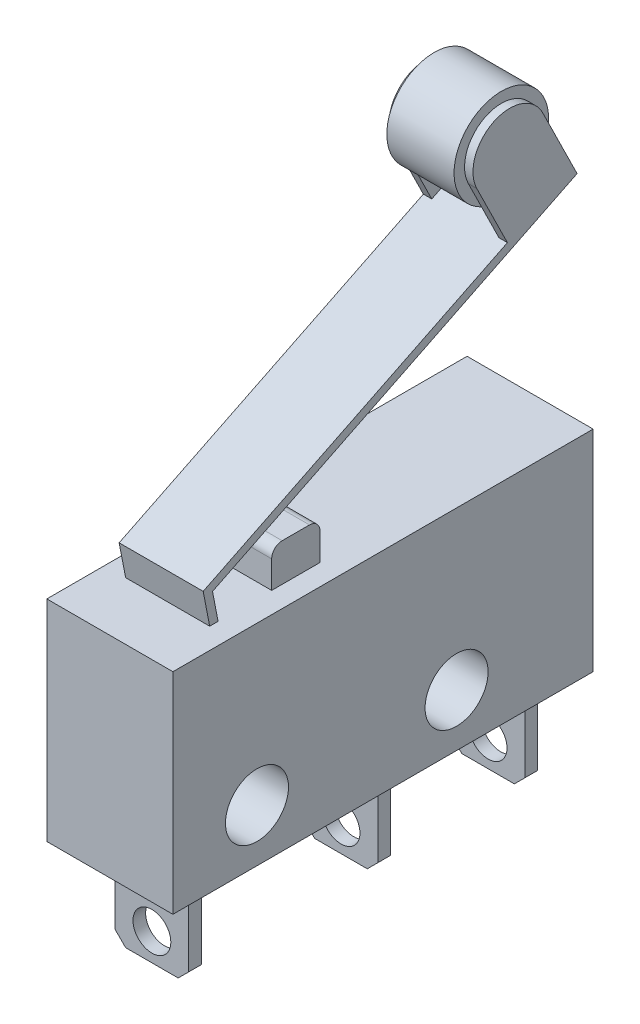
from build123d import *

# Parameters (mm, degrees)
CROQUIS2_W              = 20
CROQUIS2_H              = 10
SALIENTE_EXTRUIR1_DEPTH = 3
SALIENTE_EXTRUIR2_DEPTH = 2
CROQUIS4_W              = 3.2
CROQUIS4_H              = 5.473345926
CORTAR_EXTRUIR1_DEPTH   = 4
CROQUIS5_R              = 2.25
SALIENTE_EXTRUIR3_DEPTH = 3.2
CROQUIS6_R              = 1.5
CORTAR_EXTRUIR2_DEPTH   = 24.003733896
CROQUIS7_W              = 0.6
CROQUIS7_H              = 4.5
SALIENTE_EXTRUIR4_DEPTH = 1.75
CROQUIS8_R              = 0.9
CORTAR_EXTRUIR3_DEPTH   = 28.017462518


with BuildPart() as part:
    # Croquis2 → Saliente-Extruir1 (new, symmetric)
    with BuildSketch(Plane(origin=(0, 0, 0), x_dir=(0, 0, -1), z_dir=(1, 0, 0))):
        Rectangle(CROQUIS2_W, CROQUIS2_H)
    extrude(amount=SALIENTE_EXTRUIR1_DEPTH, both=True)

    # Croquis3 → Saliente-Extruir2 (add, symmetric)
    with BuildSketch(Plane(origin=(0, 0, 0), x_dir=(0, 0, -1), z_dir=(1, 0, 0))):
        with BuildLine():
            Line((-4.3, 5), (-4.3, 6.3))
            ThreePointArc((-4.3, 6.3), (-4.153553391, 6.653553391), (-3.8, 6.8))
            Line((-3.8, 6.8), (-2.5, 6.8))
            ThreePointArc((-2.5, 6.8), (-2.146446609, 6.653553391), (-2, 6.3))
            Line((-2, 6.3), (-2, 5))
            Line((-2, 5), (-4.3, 5))
        make_face()
        with BuildLine():
            Line((-7.25, 5), (-7.559492191, 6.592199292))
            Line((-7.559492191, 6.592199292), (6.919218672, 13.724276953))
            Line((6.919218672, 13.724276953), (5.46098718, 16.68460817))
            ThreePointArc((5.46098718, 16.68460817), (6.257555216, 19.027785364), (8.60073241, 18.231217328))
            Line((8.60073241, 18.231217328), (10.235719234, 14.912058085))
            Line((10.235719234, 14.912058085), (-6.654286119, 6.592199292))
            Line((-6.654286119, 6.592199292), (-7.115345765, 6.365085619))
            Line((-7.115345765, 6.365085619), (-6.85, 5))
            Line((-6.85, 5), (-7.25, 5))
        make_face()
    extrude(amount=SALIENTE_EXTRUIR2_DEPTH, both=True)

    # Croquis4 → Cortar-Extruir1 (cut)
    with BuildSketch(Plane(origin=(0, 5.422686469, -11.008504563), x_dir=(1, 0, 0), z_dir=(0, -0.4418883309364162, 0.8970700658155017))):
        with Locations((0, 11.990789002)):
            Rectangle(CROQUIS4_W, CROQUIS4_H)
    extrude(amount=-CORTAR_EXTRUIR1_DEPTH, mode=Mode.SUBTRACT)

    # Croquis5 → Saliente-Extruir3 (add)
    with BuildSketch(Plane.ZY.offset(-1.6)):
        with Locations((-7.030859795, 17.457912749)):
            Circle(CROQUIS5_R)
    extrude(amount=SALIENTE_EXTRUIR3_DEPTH)

    # Croquis6 → Cortar-Extruir2 (cut, through all)
    with BuildSketch(Plane(origin=(3, 0, 0), x_dir=(0, 0, -1), z_dir=(1, 0, 0))):
        with Locations((-6, -2.5)):
            Circle(CROQUIS6_R)
        with Locations((3.5, -2.5)):
            Circle(CROQUIS6_R)
    extrude(amount=-CORTAR_EXTRUIR2_DEPTH, mode=Mode.SUBTRACT)

    # Croquis7 → Saliente-Extruir4 (add, symmetric)
    with BuildSketch(Plane(origin=(0, 0, 0), x_dir=(0, 0, -1), z_dir=(1, 0, 0))):
        with Locations((-7.7, -7.25)):
            Rectangle(CROQUIS7_W, CROQUIS7_H)
        with Locations((1.3, -7.25)):
            Rectangle(CROQUIS7_W, CROQUIS7_H)
        with Locations((8.3, -7.25)):
            Rectangle(CROQUIS7_W, CROQUIS7_H)
    extrude(amount=SALIENTE_EXTRUIR4_DEPTH, both=True)

    # Croquis8 → Cortar-Extruir3 (cut, through all)
    with BuildSketch(Plane.XY.offset(8)):
        with Locations((0, -8.2)):
            Circle(CROQUIS8_R)
        Polygon((-1.75, -9), (-1.25, -9.5), (-1.75, -9.5), align=None)
        Polygon((1.25, -9.5), (1.75, -9), (1.75, -9.5), align=None)
    extrude(amount=-CORTAR_EXTRUIR3_DEPTH, mode=Mode.SUBTRACT)


solid = part.part
